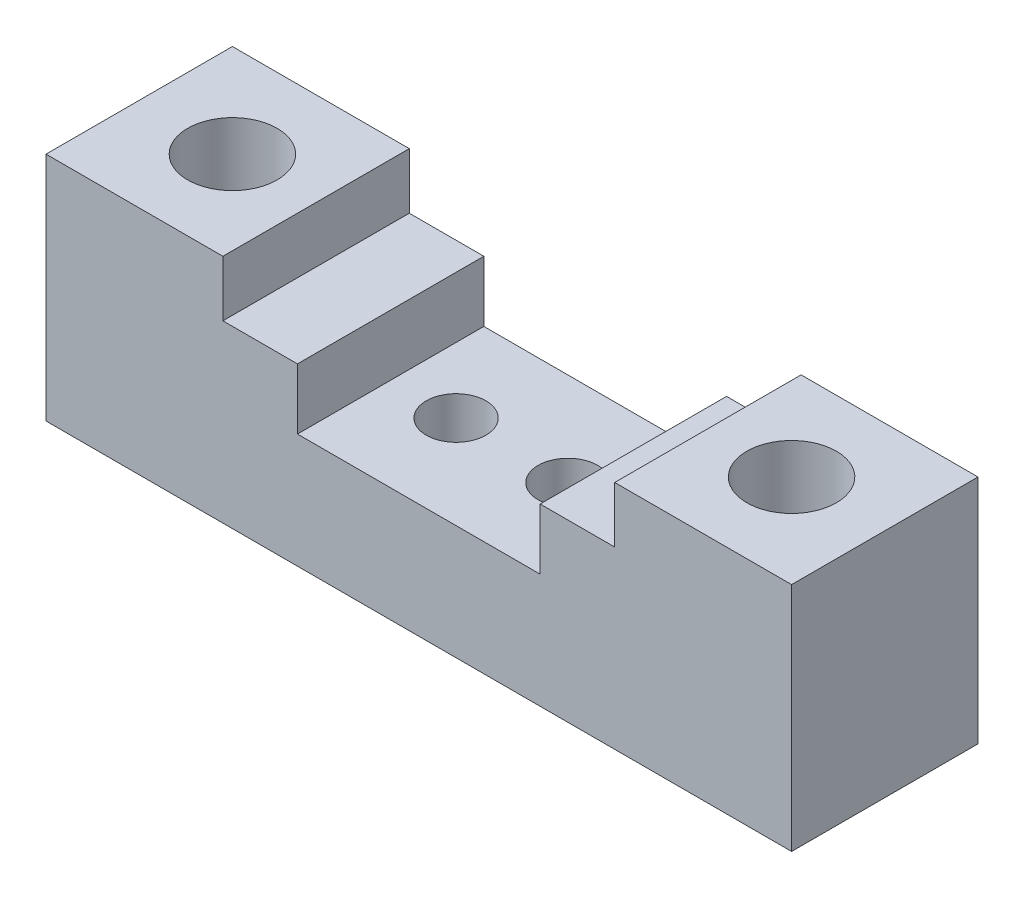
from build123d import *

# Parameters (mm, degrees)
SKETCH1_W                      = 20
SKETCH1_H                      = 5
EXTRUDE1_DEPTH                 = 6.2
SKETCH2_W                      = 10.51
SKETCH2_H                      = 5
EXTRUDE3_DEPTH                 = 1.5
SKETCH3_W                      = 6.51
SKETCH3_H                      = 5
EXTRUDE4_DEPTH                 = 1.63
CBORE_FOR_M2_SHCS1_D           = 2.4
CBORE_FOR_M2_SHCS1_CBORE_D     = 4.4
CBORE_FOR_M2_SHCS1_CBORE_DEPTH = 2
LPATTERN1_COUNT                = 2
LPATTERN1_PITCH                = 15
M2X0_4_TAPPED_HOLE1_D          = 1.6
LPATTERN3_COUNT                = 2
LPATTERN3_PITCH                = 3


with BuildPart() as part:
    # Sketch1 → Extrude1 (new body)
    with BuildSketch(Plane(origin=(0, 0, 0), x_dir=(1, 0, 0), z_dir=(0, 1, 0))):
        Rectangle(SKETCH1_W, SKETCH1_H)
    extrude(amount=EXTRUDE1_DEPTH)

    # Sketch2 → Extrude3 (cut)
    with BuildSketch(Plane(origin=(0, 6.2, 0), x_dir=(1, 0, 0), z_dir=(0, 1, 0))):
        Rectangle(SKETCH2_W, SKETCH2_H)
    extrude(amount=-EXTRUDE3_DEPTH, mode=Mode.SUBTRACT)

    # Sketch3 → Extrude4 (cut)
    with BuildSketch(Plane(origin=(0, 4.7, 0), x_dir=(1, 0, 0), z_dir=(0, 1, 0))):
        Rectangle(SKETCH3_W, SKETCH3_H)
    extrude(amount=-EXTRUDE4_DEPTH, mode=Mode.SUBTRACT)

    # CBORE for M2 SHCS1 (through all)
    with Locations(Plane(origin=(-7.5, 0, 0), x_dir=(0, 0, -1), z_dir=(0, -1, 0))):
        with Locations((0, 0)):
            cbore_for_m2_shcs1 = CounterBoreHole(CBORE_FOR_M2_SHCS1_D / 2, CBORE_FOR_M2_SHCS1_CBORE_D / 2, CBORE_FOR_M2_SHCS1_CBORE_DEPTH)

    # LPattern1: CBORE for M2 SHCS1 ×2
    with Locations(*[(i * LPATTERN1_PITCH, 0, 0) for i in range(1, LPATTERN1_COUNT)]):
        add(cbore_for_m2_shcs1, mode=Mode.SUBTRACT)

    # M2x0.4 Tapped Hole1 (through all)
    with Locations(Plane(origin=(-1.5, 0, 0), x_dir=(0, 0, -1), z_dir=(0, -1, 0))):
        with Locations((0, 0)):
            m2x0_4_tapped_hole1 = Hole(M2X0_4_TAPPED_HOLE1_D / 2)

    # LPattern3: M2x0.4 Tapped Hole1 ×2
    with Locations(*[(i * LPATTERN3_PITCH, 0, 0) for i in range(1, LPATTERN3_COUNT)]):
        add(m2x0_4_tapped_hole1, mode=Mode.SUBTRACT)


solid = part.part
